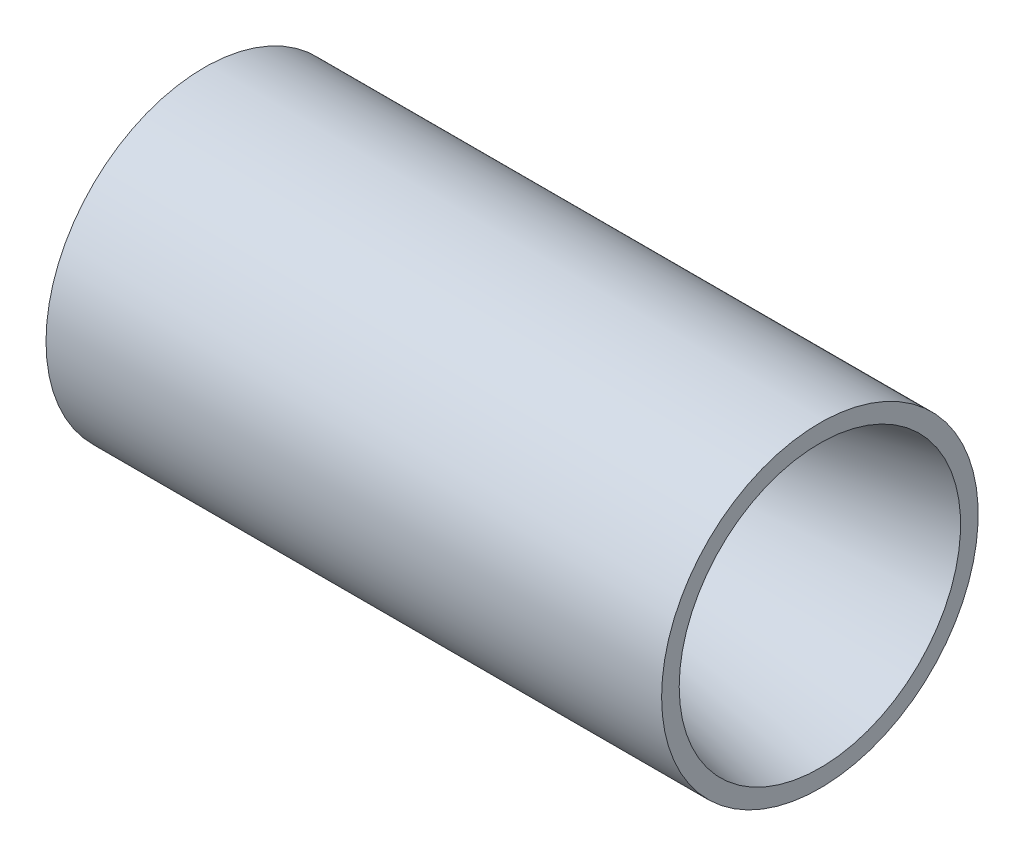
from build123d import *


with BuildPart() as part:
    # Эскиз1 → Повернуть1 (revolve)
    with BuildSketch(Plane.XY, mode=Mode.PRIVATE) as revolve_1_sk:
        with BuildLine():
            Line((0, 8), (0, 9))
            Line((0, 9), (35, 9))
            Line((35, 9), (35, 8))
            Line((35, 8), (10.656588902, 3.117174161))
            ThreePointArc((10.656588902, 3.117174161), (8.349331756, 3.106846917), (6.208771579, 3.967976592))
            Line((6.208771579, 3.967976592), (0, 8))
        make_face()
    revolve(revolve_1_sk.sketch.rotate(Axis((0, 0, 0), (1, 0, 0)), 90), axis=Axis((0, 0, 0), (1, 0, 0)))


solid = part.part
